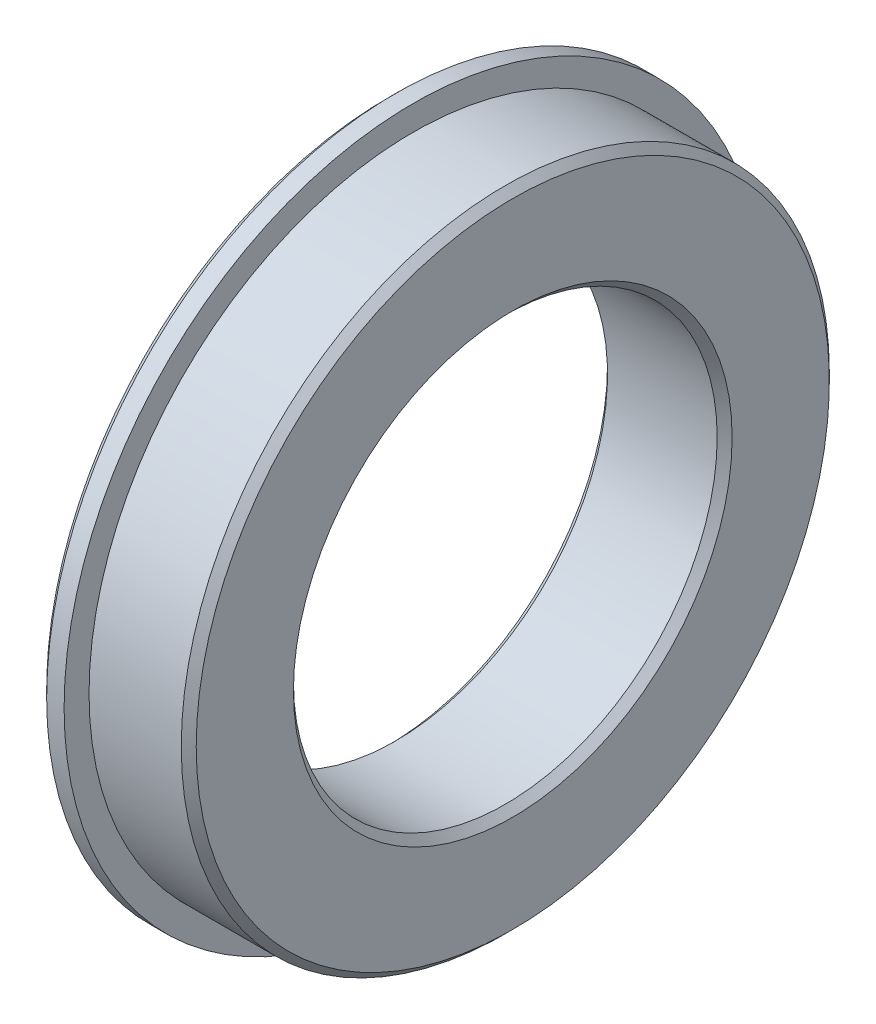
from build123d import *

# Parameters (mm, degrees)
SKETCH_1_R          = 14
SKETCH_1_R_2        = 8.5
EXTRUDE_1_DEPTH     = 5
SKETCH_2_R          = 16.127190563
SKETCH_2_R_2        = 13
CUT_EXTRUDE_1_DEPTH = 4
CHAMFER_1_SIZE      = 0.3


with BuildPart() as part:
    # 草图1 → 凸台-拉伸1 (new body)
    with BuildSketch(Plane(origin=(0, 0, 0), x_dir=(0, 0, -1), z_dir=(1, 0, 0))):
        Circle(SKETCH_1_R)
        Circle(SKETCH_1_R_2, mode=Mode.SUBTRACT)
    extrude(amount=EXTRUDE_1_DEPTH)

    # 草图2 → 切除-拉伸1 (cut)
    with BuildSketch(Plane(origin=(5, 0, 0), x_dir=(0, 0, -1), z_dir=(1, 0, 0))):
        Circle(SKETCH_2_R)
        Circle(SKETCH_2_R_2, mode=Mode.SUBTRACT)
    extrude(amount=-CUT_EXTRUDE_1_DEPTH, mode=Mode.SUBTRACT)

    # 倒角1
    chamfer_1_edges = [part.edges().sort_by_distance(p)[0] for p in [
        (5, 0, 13),
        (0, 0, 14),
        (0, 0, 8.5),
        (5, 0, 8.5),
    ]]
    chamfer(chamfer_1_edges, length=CHAMFER_1_SIZE)


solid = part.part
